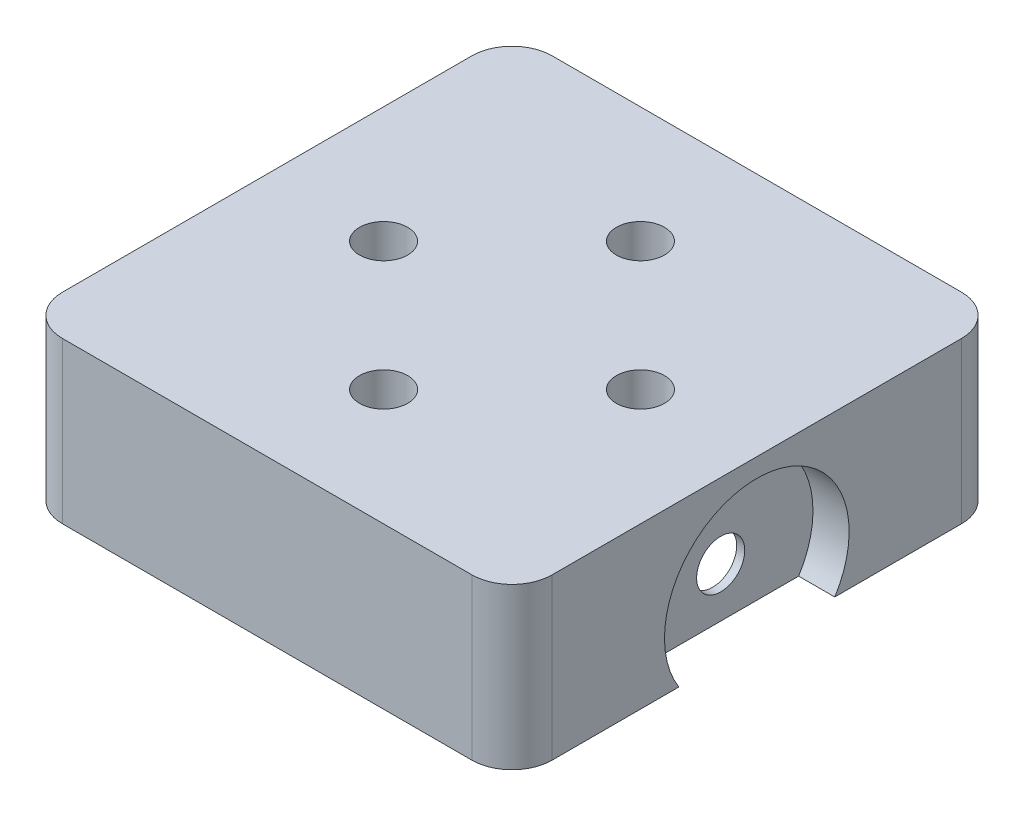
from build123d import *

# Parameters (mm, degrees)
BOSS_EXTRUDE1_DEPTH     = 200
SKETCH4_R               = 30
CUT_EXTRUDE1_DEPTH      = 60
SHELL1_T                = -20
BOSS_EXTRUDE2_DEPTH     = 200
SKETCH6_R               = 115
CUT_EXTRUDE3_DEPTH      = 50
CUT_EXTRUDE4_DEPTH      = 716.017482304
CUT_EXTRUDE4_DEPTH_BACK = 716.017482304
SKETCH7_R               = 30


with BuildPart() as part:
    # Sketch1 → Boss-Extrude1 (new body)
    with BuildSketch(Plane(origin=(0, 0, 0), x_dir=(1, 0, 0), z_dir=(0, 1, 0))):
        with BuildLine():
            Line((-220, 270), (220, 270))
            ThreePointArc((220, 270), (255.355339059, 255.355339059), (270, 220))
            Line((270, 220), (270, -220))
            ThreePointArc((270, -220), (255.355339059, -255.355339059), (220, -270))
            Line((220, -270), (-220, -270))
            ThreePointArc((-220, -270), (-255.355339059, -255.355339059), (-270, -220))
            Line((-270, -220), (-270, 220))
            ThreePointArc((-270, 220), (-255.355339059, 255.355339059), (-220, 270))
        make_face()
    extrude(amount=BOSS_EXTRUDE1_DEPTH)

    # Sketch4 → Cut-Extrude1 (cut)
    with BuildSketch(Plane(origin=(0, 200, 0), x_dir=(1, 0, 0), z_dir=(0, 1, 0))):
        with Locations(Location((0, 160, 0), (0, 0, 270))):
            Circle(SKETCH4_R)
        with Locations(Location((160, 0, 0), (0, 0, 270))):
            Circle(SKETCH4_R)
        with Locations(Location((0, -160, 0), (0, 0, 270))):
            Circle(SKETCH4_R)
        with Locations(Location((-160, 0, 0), (0, 0, 270))):
            Circle(SKETCH4_R)
    extrude(amount=-CUT_EXTRUDE1_DEPTH, mode=Mode.SUBTRACT)

    # Shell1
    shell1_openings = [part.faces().sort_by_distance(p)[0] for p in [
        (0, 0, 0),
    ]]
    offset(amount=SHELL1_T, openings=shell1_openings, kind=Kind.INTERSECTION)

    # Sketch5 → Boss-Extrude2 (add)
    with BuildSketch(Plane(origin=(0, 0, 0), x_dir=(1, 0, 0), z_dir=(0, 1, 0))):
        with BuildLine():
            Line((-255, 305), (255, 305))
            ThreePointArc((255, 305), (290.355339059, 290.355339059), (305, 255))
            Line((305, 255), (305, -255))
            ThreePointArc((305, -255), (290.355339059, -290.355339059), (255, -305))
            Line((255, -305), (-255, -305))
            ThreePointArc((-255, -305), (-290.355339059, -290.355339059), (-305, -255))
            Line((-305, -255), (-305, 255))
            ThreePointArc((-305, 255), (-290.355339059, 290.355339059), (-255, 305))
        make_face()
        with BuildLine():
            Line((-220, 270), (220, 270))
            ThreePointArc((220, 270), (255.355339059, 255.355339059), (270, 220))
            Line((270, 220), (270, -220))
            ThreePointArc((270, -220), (255.355339059, -255.355339059), (220, -270))
            Line((220, -270), (-220, -270))
            ThreePointArc((-220, -270), (-255.355339059, -255.355339059), (-270, -220))
            Line((-270, -220), (-270, 220))
            ThreePointArc((-270, 220), (-255.355339059, 255.355339059), (-220, 270))
        make_face(mode=Mode.SUBTRACT)
    extrude(amount=BOSS_EXTRUDE2_DEPTH)

    # Sketch6 → Cut-Extrude3 (cut)
    with BuildSketch(Plane(origin=(310, 0, 0), x_dir=(0, 0, -1), z_dir=(1, 0, 0))):
        with Locations((0, 61.568690233)):
            Circle(SKETCH6_R)
    cut_extrude3 = extrude(amount=-CUT_EXTRUDE3_DEPTH, mode=Mode.SUBTRACT)

    # Sketch7 → Cut-Extrude4 (cut, two sides: drawn at the far end of the back side and taken through both)
    with BuildSketch(Plane(origin=(310, 0, 0), x_dir=(0, 0, -1), z_dir=(1, 0, 0)).offset(-CUT_EXTRUDE4_DEPTH_BACK)):
        with Locations((0, 61.568690233)):
            Circle(SKETCH7_R)
    extrude(amount=CUT_EXTRUDE4_DEPTH + CUT_EXTRUDE4_DEPTH_BACK, mode=Mode.SUBTRACT)

    # Mirror1: Cut-Extrude3 across plane
    add(cut_extrude3.mirror(Plane(origin=(0, 0, 0), x_dir=(0, 0, 1), z_dir=(1, 0, 0))), mode=Mode.SUBTRACT)


solid = part.part
